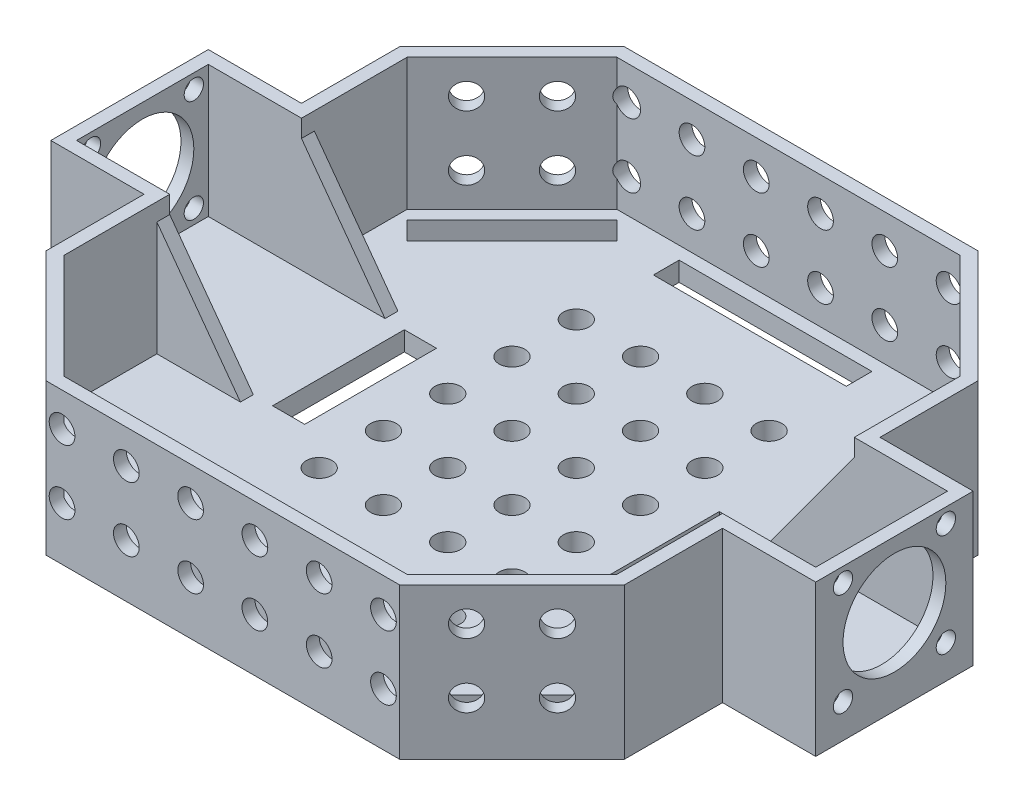
from build123d import *

# Parameters (mm, degrees)
SKETCH1_W                       = 90
SKETCH1_H                       = 90
BOSS_EXTRUDE1_DEPTH             = 3
SKETCH2_W                       = 14.5
SKETCH2_H                       = 20.5
BOSS_EXTRUDE2_DEPTH             = 3
SKETCH3_W                       = 2
SKETCH3_H                       = 20.5
BOSS_EXTRUDE3_DEPTH             = 20.5
CUT_EXTRUDE1_DEPTH              = 150.469896635
CUT_EXTRUDE1_DEPTH_BACK         = 150.469896635
SKETCH4_R                       = 8
SKETCH4_R_2                     = 1.5
BOSS_EXTRUDE4_REACH             = 141.429
SKETCH5_W                       = 16.5
SKETCH5_H                       = 2
BOSS_EXTRUDE4_DIRECTION_2_REACH = 141.429
BOSS_EXTRUDE5_REACH             = 123.45
SKETCH7_W                       = 115
SKETCH7_H                       = 20.5
CUT_EXTRUDE2_DEPTH              = 140.4291935
SKETCH8_W                       = 5
SKETCH8_H                       = 20.5
CUT_EXTRUDE3_DEPTH              = 140.4291935
CUT_EXTRUDE4_DEPTH              = 140.90175124
BOSS_EXTRUDE6_DEPTH             = 20.5
SKETCH11_R                      = 2
CUT_EXTRUDE5_DEPTH              = 140.90175124
SKETCH12_R                      = 2
CUT_EXTRUDE6_DEPTH              = 128.757093737
SKETCH13_R                      = 2
CUT_EXTRUDE7_DEPTH              = 153.485655063
SKETCH14_R                      = 2
SKETCH14_W                      = 15
SKETCH14_H                      = 4
CUT_EXTRUDE8_DEPTH              = 140.4291935


with BuildPart() as part:
    # Sketch1 → Boss-Extrude1 (new body)
    with BuildSketch(Plane(origin=(0, 0, 0), x_dir=(1, 0, 0), z_dir=(0, 1, 0))):
        with Locations((45, 45)):
            Rectangle(SKETCH1_W, SKETCH1_H)
    extrude(amount=BOSS_EXTRUDE1_DEPTH)

    # Sketch2 → Boss-Extrude2 (add)
    with BuildSketch(Plane(origin=(0, 3, 0), x_dir=(1, 0, 0), z_dir=(0, 1, 0))):
        with Locations((-7.25, 45)):
            Rectangle(SKETCH2_W, SKETCH2_H)
        with Locations((97.25, 45)):
            Rectangle(SKETCH2_W, SKETCH2_H)
    extrude(amount=-BOSS_EXTRUDE2_DEPTH)

    # Sketch3 → Boss-Extrude3 (add)
    with BuildSketch(Plane(origin=(0, 3, 0), x_dir=(1, 0, 0), z_dir=(0, 1, 0))):
        with Locations((-13.5, 45)):
            Rectangle(SKETCH3_W, SKETCH3_H)
        with Locations((103.5, 45)):
            Rectangle(SKETCH3_W, SKETCH3_H)
    extrude(amount=BOSS_EXTRUDE3_DEPTH)

    # Sketch4 → Cut-Extrude1 (cut, two sides: drawn at the far end of the back side and taken through both)
    with BuildSketch(Plane(origin=(-12.5, 0, 0), x_dir=(0, 0, -1), z_dir=(1, 0, 0)).offset(-CUT_EXTRUDE1_DEPTH_BACK)):
        with Locations((45, 13.25)):
            Circle(SKETCH4_R)
        with Locations((53, 21.25)):
            Circle(SKETCH4_R_2)
        with Locations((53, 5.25)):
            Circle(SKETCH4_R_2)
        with Locations((37, 21.25)):
            Circle(SKETCH4_R_2)
        with Locations((37, 5.25)):
            Circle(SKETCH4_R_2)
    extrude(amount=CUT_EXTRUDE1_DEPTH + CUT_EXTRUDE1_DEPTH_BACK, mode=Mode.SUBTRACT)

    # Boss-Extrude4: up to this face of the body (flat: up to its plane)
    boss_extrude4_end = Plane(part.part.faces().sort_by_distance((45, 0, -45))[0])
    # Sketch5 → Boss-Extrude4 (add, up to the picked face)
    with BuildSketch(Plane(origin=(0, 3, 0), x_dir=(1, 0, 0), z_dir=(0, 1, 0)), mode=Mode.PRIVATE) as boss_extrude4_sk1:
        with Locations((-6.25, 33.75)):
            Rectangle(SKETCH5_W, SKETCH5_H)
    boss_extrude4_tool1 = split(extrude(boss_extrude4_sk1.sketch, amount=-BOSS_EXTRUDE4_REACH, mode=Mode.PRIVATE), bisect_by=boss_extrude4_end, keep=Keep.BOTH, mode=Mode.PRIVATE)
    # Sketch5 → Boss-Extrude4 (add, up to the picked face)
    with BuildSketch(Plane(origin=(0, 3, 0), x_dir=(1, 0, 0), z_dir=(0, 1, 0)), mode=Mode.PRIVATE) as boss_extrude4_sk2:
        with Locations((-6.25, 56.25)):
            Rectangle(SKETCH5_W, SKETCH5_H)
    boss_extrude4_tool2 = split(extrude(boss_extrude4_sk2.sketch, amount=-BOSS_EXTRUDE4_REACH, mode=Mode.PRIVATE), bisect_by=boss_extrude4_end, keep=Keep.BOTH, mode=Mode.PRIVATE)
    # Sketch5 → Boss-Extrude4 (add, up to the picked face)
    with BuildSketch(Plane(origin=(0, 3, 0), x_dir=(1, 0, 0), z_dir=(0, 1, 0)), mode=Mode.PRIVATE) as boss_extrude4_sk3:
        with Locations((96.25, 33.75)):
            Rectangle(SKETCH5_W, SKETCH5_H)
    boss_extrude4_tool3 = split(extrude(boss_extrude4_sk3.sketch, amount=-BOSS_EXTRUDE4_REACH, mode=Mode.PRIVATE), bisect_by=boss_extrude4_end, keep=Keep.BOTH, mode=Mode.PRIVATE)
    # Sketch5 → Boss-Extrude4 (add, up to the picked face)
    with BuildSketch(Plane(origin=(0, 3, 0), x_dir=(1, 0, 0), z_dir=(0, 1, 0)), mode=Mode.PRIVATE) as boss_extrude4_sk4:
        with Locations((96.25, 56.25)):
            Rectangle(SKETCH5_W, SKETCH5_H)
    boss_extrude4_tool4 = split(extrude(boss_extrude4_sk4.sketch, amount=-BOSS_EXTRUDE4_REACH, mode=Mode.PRIVATE), bisect_by=boss_extrude4_end, keep=Keep.BOTH, mode=Mode.PRIVATE)
    add(boss_extrude4_tool1.solids().sort_by(Axis((-6.25, 3, -33.75), (0, -1, 0)))[0])
    add(boss_extrude4_tool2.solids().sort_by(Axis((-6.25, 3, -56.25), (0, -1, 0)))[0])
    add(boss_extrude4_tool3.solids().sort_by(Axis((96.25, 3, -33.75), (0, -1, 0)))[0])
    add(boss_extrude4_tool4.solids().sort_by(Axis((96.25, 3, -56.25), (0, -1, 0)))[0])

    # Boss-Extrude4 direction 2: up to this face of the body (flat: up to its plane)
    boss_extrude4_direction_2_end = Plane(part.part.faces().sort_by_distance((103.5, 23.5, -45))[0])
    # Sketch5 → Boss-Extrude4 direction 2 (add, up to the picked face)
    with BuildSketch(Plane(origin=(0, 3, 0), x_dir=(1, 0, 0), z_dir=(0, 1, 0)), mode=Mode.PRIVATE) as boss_extrude4_direction_2_sk1:
        with Locations((-6.25, 33.75)):
            Rectangle(SKETCH5_W, SKETCH5_H)
    boss_extrude4_direction_2_tool1 = split(extrude(boss_extrude4_direction_2_sk1.sketch, amount=BOSS_EXTRUDE4_DIRECTION_2_REACH, mode=Mode.PRIVATE), bisect_by=boss_extrude4_direction_2_end, keep=Keep.BOTH, mode=Mode.PRIVATE)
    # Sketch5 → Boss-Extrude4 direction 2 (add, up to the picked face)
    with BuildSketch(Plane(origin=(0, 3, 0), x_dir=(1, 0, 0), z_dir=(0, 1, 0)), mode=Mode.PRIVATE) as boss_extrude4_direction_2_sk2:
        with Locations((-6.25, 56.25)):
            Rectangle(SKETCH5_W, SKETCH5_H)
    boss_extrude4_direction_2_tool2 = split(extrude(boss_extrude4_direction_2_sk2.sketch, amount=BOSS_EXTRUDE4_DIRECTION_2_REACH, mode=Mode.PRIVATE), bisect_by=boss_extrude4_direction_2_end, keep=Keep.BOTH, mode=Mode.PRIVATE)
    # Sketch5 → Boss-Extrude4 direction 2 (add, up to the picked face)
    with BuildSketch(Plane(origin=(0, 3, 0), x_dir=(1, 0, 0), z_dir=(0, 1, 0)), mode=Mode.PRIVATE) as boss_extrude4_direction_2_sk3:
        with Locations((96.25, 33.75)):
            Rectangle(SKETCH5_W, SKETCH5_H)
    boss_extrude4_direction_2_tool3 = split(extrude(boss_extrude4_direction_2_sk3.sketch, amount=BOSS_EXTRUDE4_DIRECTION_2_REACH, mode=Mode.PRIVATE), bisect_by=boss_extrude4_direction_2_end, keep=Keep.BOTH, mode=Mode.PRIVATE)
    # Sketch5 → Boss-Extrude4 direction 2 (add, up to the picked face)
    with BuildSketch(Plane(origin=(0, 3, 0), x_dir=(1, 0, 0), z_dir=(0, 1, 0)), mode=Mode.PRIVATE) as boss_extrude4_direction_2_sk4:
        with Locations((96.25, 56.25)):
            Rectangle(SKETCH5_W, SKETCH5_H)
    boss_extrude4_direction_2_tool4 = split(extrude(boss_extrude4_direction_2_sk4.sketch, amount=BOSS_EXTRUDE4_DIRECTION_2_REACH, mode=Mode.PRIVATE), bisect_by=boss_extrude4_direction_2_end, keep=Keep.BOTH, mode=Mode.PRIVATE)
    add(boss_extrude4_direction_2_tool1.solids().sort_by(Axis((-6.25, 3, -33.75), (0, 1, 0)))[0])
    add(boss_extrude4_direction_2_tool2.solids().sort_by(Axis((-6.25, 3, -56.25), (0, 1, 0)))[0])
    add(boss_extrude4_direction_2_tool3.solids().sort_by(Axis((96.25, 3, -33.75), (0, 1, 0)))[0])
    add(boss_extrude4_direction_2_tool4.solids().sort_by(Axis((96.25, 3, -56.25), (0, 1, 0)))[0])

    # Boss-Extrude5: up to this face of the body (flat: up to its plane)
    boss_extrude5_end = Plane(part.part.faces().sort_by_distance((96.363948919, 11.911100196, -32.75))[0])
    # Sketch6 → Boss-Extrude5 (add, up to the picked face)
    with BuildSketch(Plane(origin=(0, 0, -57.25), x_dir=(-1, 0, 0), z_dir=(0, 0, -1)), mode=Mode.PRIVATE) as boss_extrude5_sk1:
        Polygon((-90, 23.5), (-75, 3), (-90, 3), align=None)
    boss_extrude5_tool1 = split(extrude(boss_extrude5_sk1.sketch, amount=-BOSS_EXTRUDE5_REACH, mode=Mode.PRIVATE), bisect_by=boss_extrude5_end, keep=Keep.BOTH, mode=Mode.PRIVATE)
    # Sketch6 → Boss-Extrude5 (add, up to the picked face)
    with BuildSketch(Plane(origin=(0, 0, -57.25), x_dir=(-1, 0, 0), z_dir=(0, 0, -1)), mode=Mode.PRIVATE) as boss_extrude5_sk2:
        Polygon((0, 23.5), (-15, 3), (0, 3), align=None)
    boss_extrude5_tool2 = split(extrude(boss_extrude5_sk2.sketch, amount=-BOSS_EXTRUDE5_REACH, mode=Mode.PRIVATE), bisect_by=boss_extrude5_end, keep=Keep.BOTH, mode=Mode.PRIVATE)
    add(boss_extrude5_tool1.solids().sort_by(Axis((85, 9.833333, -57.25), (0, 0, 1)))[0])
    add(boss_extrude5_tool2.solids().sort_by(Axis((5, 9.833333, -57.25), (0, 0, 1)))[0])

    # Sketch7 → Cut-Extrude2 (cut, through all)
    with BuildSketch(Plane(origin=(0, 3, 0), x_dir=(1, 0, 0), z_dir=(0, 1, 0))):
        with Locations((45, 45)):
            Rectangle(SKETCH7_W, SKETCH7_H)
    extrude(amount=CUT_EXTRUDE2_DEPTH, mode=Mode.SUBTRACT)

    # Sketch8 → Cut-Extrude3 (cut, through all)
    with BuildSketch(Plane(origin=(0, 3, 0), x_dir=(1, 0, 0), z_dir=(0, 1, 0))):
        with Locations((20.5, 45)):
            Rectangle(SKETCH8_W, SKETCH8_H)
        with Locations((69.5, 45)):
            Rectangle(SKETCH8_W, SKETCH8_H)
    extrude(amount=-CUT_EXTRUDE3_DEPTH, mode=Mode.SUBTRACT)

    # Sketch9 → Cut-Extrude4 (cut, through all)
    with BuildSketch(Plane.XZ):
        Polygon((17.5, 0), (0, -17.5), (0, 0), align=None)
        Polygon((0, -72.5), (17.5, -90), (0, -90), align=None)
        Polygon((72.5, -90), (90, -90), (90, -72.5), align=None)
        Polygon((90, -17.5), (90, 0), (72.5, 0), align=None)
    extrude(amount=-CUT_EXTRUDE4_DEPTH, mode=Mode.SUBTRACT)

    # Sketch10 → Boss-Extrude6 (add)
    with BuildSketch(Plane(origin=(0, 3, 0), x_dir=(1, 0, 0), z_dir=(0, 1, 0))):
        Polygon((88, 32.75), (88, 18.328427125), (71.671572875, 2), (18.328427125, 2), (2, 18.328427125), (2, 32.75), (0, 32.75), (0, 17.5), (17.5, 0), (72.5, 0), (90, 17.5), (90, 32.75), align=None)
        Polygon((90, 57.25), (90, 72.5), (72.5, 90), (17.5, 90), (0, 72.5), (0, 57.25), (2, 57.25), (2, 71.671572875), (18.328427125, 88), (71.671572875, 88), (88, 71.671572875), (88, 57.25), align=None)
    extrude(amount=BOSS_EXTRUDE6_DEPTH)

    # Sketch11 → Cut-Extrude5 (cut, through all)
    with BuildSketch(Plane.XY):
        with Locations((20, 18.25)):
            Circle(SKETCH11_R)
        with Locations((30, 8.25)):
            Circle(SKETCH11_R)
        with Locations((30, 18.25)):
            Circle(SKETCH11_R)
        with Locations((40, 18.25)):
            Circle(SKETCH11_R)
        with Locations((50, 18.25)):
            Circle(SKETCH11_R)
        with Locations((60, 18.25)):
            Circle(SKETCH11_R)
        with Locations((70, 18.25)):
            Circle(SKETCH11_R)
        with Locations((40, 8.25)):
            Circle(SKETCH11_R)
        with Locations((20, 8.25)):
            Circle(SKETCH11_R)
        with Locations((70, 8.25)):
            Circle(SKETCH11_R)
        with Locations((60, 8.25)):
            Circle(SKETCH11_R)
        with Locations((50, 8.25)):
            Circle(SKETCH11_R)
    extrude(amount=-CUT_EXTRUDE5_DEPTH, mode=Mode.SUBTRACT)

    # Sketch12 → Cut-Extrude6 (cut, through all)
    with BuildSketch(Plane(origin=(8.75, 0, -8.75), x_dir=(0.7071067811865475, 0, 0.7071067811865477), z_dir=(-0.7071067811865477, 0, 0.7071067811865475))):
        with Locations((-5, 18.25)):
            Circle(SKETCH12_R)
        with Locations((5, 18.25)):
            Circle(SKETCH12_R)
        with Locations((5, 8.25)):
            Circle(SKETCH12_R)
        with Locations((-5, 8.25)):
            Circle(SKETCH12_R)
    extrude(amount=-CUT_EXTRUDE6_DEPTH, mode=Mode.SUBTRACT)

    # Sketch13 → Cut-Extrude7 (cut, through all)
    with BuildSketch(Plane(origin=(-36.25, 0, -36.25), x_dir=(-0.7071067811865475, 0, 0.7071067811865477), z_dir=(-0.7071067811865477, 0, -0.7071067811865475))):
        with Locations((-68.639610307, 18.25)):
            Circle(SKETCH13_R)
        with Locations((-58.639610307, 18.25)):
            Circle(SKETCH13_R)
        with Locations((-58.639610307, 8.25)):
            Circle(SKETCH13_R)
        with Locations((-68.639610307, 8.25)):
            Circle(SKETCH13_R)
    extrude(amount=-CUT_EXTRUDE7_DEPTH, mode=Mode.SUBTRACT)

    # Sketch14 → Cut-Extrude8 (cut, through all)
    with BuildSketch(Plane(origin=(0, 3, 0), x_dir=(1, 0, 0), z_dir=(0, 1, 0))):
        with Locations(Location((60, 70, 0), (0, 0, 270))):
            Circle(SKETCH14_R)
        with Locations((52.5, 84)):
            Rectangle(SKETCH14_W, SKETCH14_H)
        with Locations((37.5, 84)):
            Rectangle(SKETCH14_W, SKETCH14_H)
        with Locations(Location((40, 70, 0), (0, 0, 270))):
            Circle(SKETCH14_R)
        with Locations(Location((50, 70, 0), (0, 0, 270))):
            Circle(SKETCH14_R)
        with Locations(Location((50, 60, 0), (0, 0, 270))):
            Circle(SKETCH14_R)
        with Locations(Location((60, 50, 0), (0, 0, 270))):
            Circle(SKETCH14_R)
        with Locations(Location((50, 40, 0), (0, 0, 270))):
            Circle(SKETCH14_R)
        with Locations(Location((50, 30, 0), (0, 0, 270))):
            Circle(SKETCH14_R)
        with Locations(Location((60, 30, 0), (0, 0, 270))):
            Circle(SKETCH14_R)
        with Locations(Location((60, 20, 0), (0, 0, 270))):
            Circle(SKETCH14_R)
        with Locations(Location((50, 20, 0), (0, 0, 270))):
            Circle(SKETCH14_R)
        with Locations(Location((40, 20, 0), (0, 0, 270))):
            Circle(SKETCH14_R)
        with Locations(Location((40, 40, 0), (0, 0, 270))):
            Circle(SKETCH14_R)
        with Locations(Location((30, 30, 0), (0, 0, 270))):
            Circle(SKETCH14_R)
        with Locations(Location((30, 20, 0), (0, 0, 270))):
            Circle(SKETCH14_R)
        with Locations((37.5, 6)):
            Rectangle(SKETCH14_W, SKETCH14_H)
        with Locations((52.5, 6)):
            Rectangle(SKETCH14_W, SKETCH14_H)
        Polygon((83.757359313, 22.571067812), (86.585786438, 19.742640687), (70.257359313, 3.414213562), (67.428932188, 6.242640687), align=None)
        Polygon((83.757359313, 67.428932188), (86.585786438, 70.257359313), (70.257359313, 86.585786438), (67.428932188, 83.757359313), align=None)
        Polygon((19.742640687, 86.585786438), (22.571067812, 83.757359313), (6.242640687, 67.428932188), (3.414213562, 70.257359313), align=None)
        Polygon((22.571067812, 6.242640687), (6.242640687, 22.571067812), (3.414213562, 19.742640687), (19.742640687, 3.414213562), align=None)
        with Locations(Location((40, 50, 0), (0, 0, 270))):
            Circle(SKETCH14_R)
        with Locations(Location((40, 60, 0), (0, 0, 270))):
            Circle(SKETCH14_R)
        with Locations(Location((30, 60, 0), (0, 0, 270))):
            Circle(SKETCH14_R)
        with Locations(Location((30, 70, 0), (0, 0, 270))):
            Circle(SKETCH14_R)
        with Locations(Location((60, 60, 0), (0, 0, 90))):
            Circle(SKETCH14_R)
        with Locations(Location((50, 50, 0), (0, 0, 90))):
            Circle(SKETCH14_R)
        with Locations(Location((60, 40, 0), (0, 0, 270))):
            Circle(SKETCH14_R)
        with Locations(Location((40, 30, 0), (0, 0, 90))):
            Circle(SKETCH14_R)
        with Locations(Location((30, 40, 0), (0, 0, 90))):
            Circle(SKETCH14_R)
        with Locations(Location((30, 50, 0), (0, 0, 270))):
            Circle(SKETCH14_R)
    extrude(amount=-CUT_EXTRUDE8_DEPTH, mode=Mode.SUBTRACT)


solid = part.part
